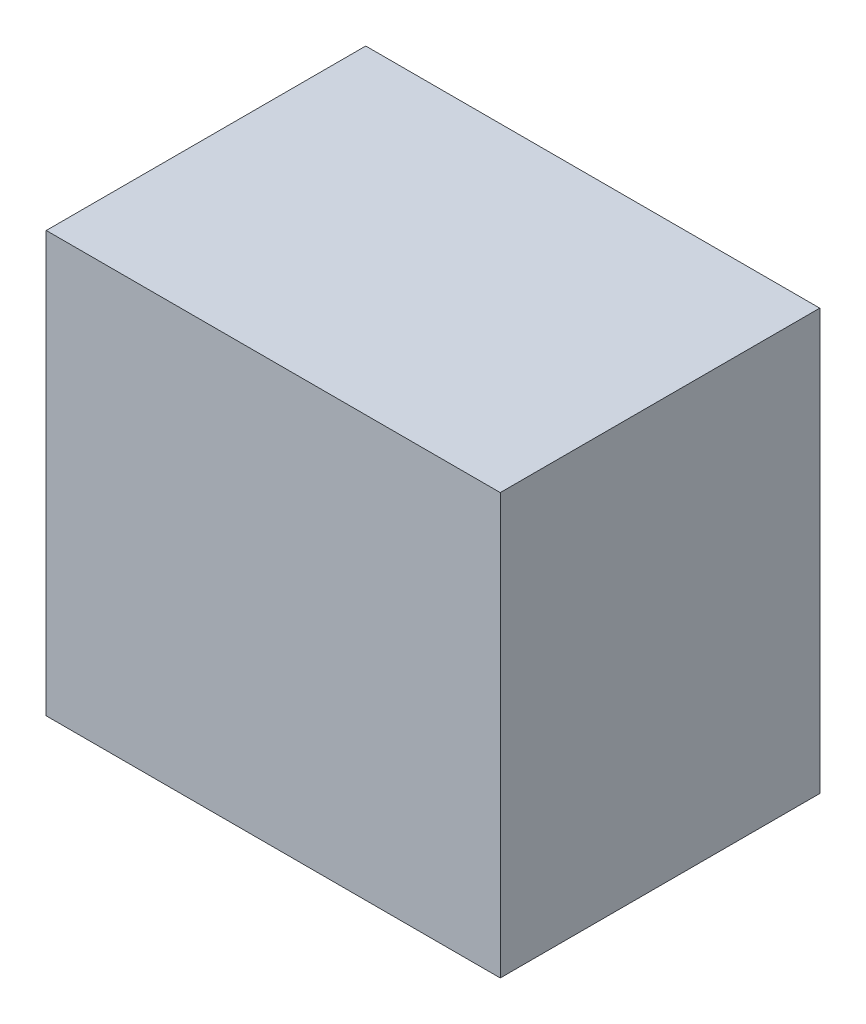
from build123d import *

# Parameters (mm, degrees)
SKETCH_1_W      = 5.4
SKETCH_1_H      = 3.8
EXTRUDE_1_DEPTH = 5


with BuildPart() as part:
    # Эскиз1 → Бобышка-Вытянуть1 (new body)
    with BuildSketch(Plane(origin=(0, 0, 0), x_dir=(1, 0, 0), z_dir=(0, 1, 0))):
        with Locations((2.7, 1.9)):
            Rectangle(SKETCH_1_W, SKETCH_1_H)
    extrude(amount=EXTRUDE_1_DEPTH)


solid = part.part
